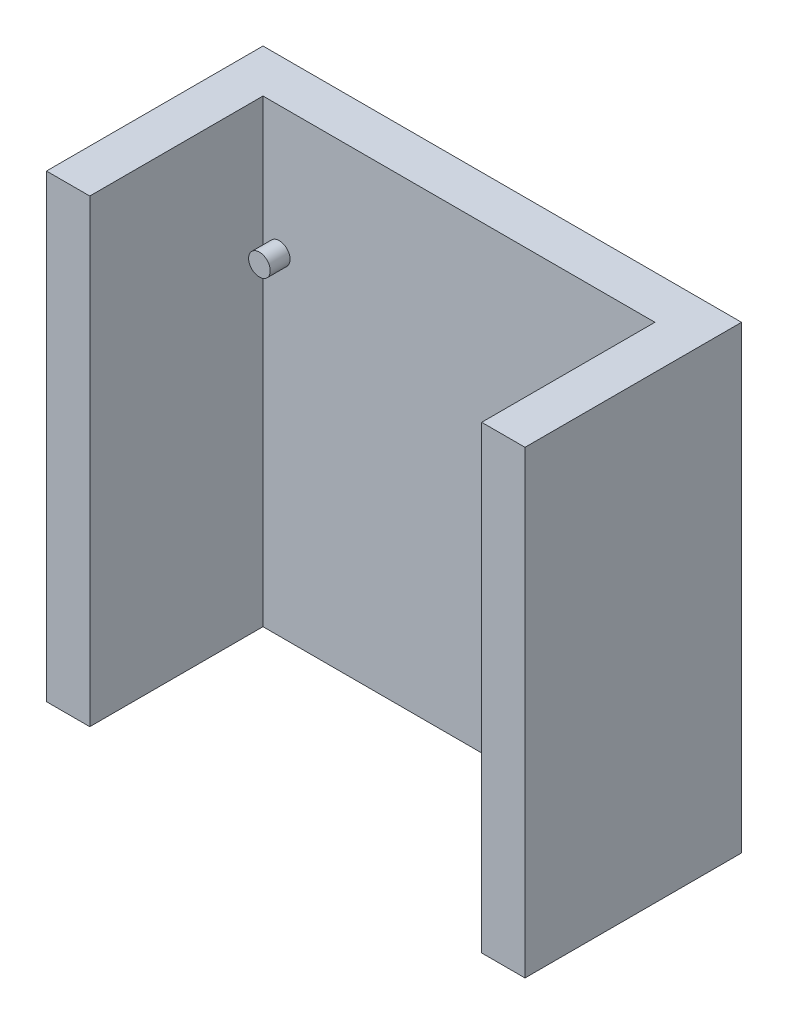
from build123d import *

# Parameters (mm, degrees)
SKETCH3_W             = 145
SKETCH3_H             = 0.3
BOSS_EXTRUDE1_DEPTH   = 1250
BOSS_EXTRUDE2_DEPTH   = 1250
BOSS_EXTRUDE2_2_DEPTH = 1250
BOSS_EXTRUDE2_3_DEPTH = 1250
SKETCH5_W             = 460.32256347
SKETCH5_H             = 1322.59999933
BOSS_EXTRUDE3_DEPTH   = 10
SKETCH6_W             = 460.32256347
SKETCH6_H             = 1322.59999933
BOSS_EXTRUDE5_DEPTH   = 10
SKETCH10_R            = 50
SKETCH12_R            = 50
SKETCH14_R            = 51
SKETCH14_R_2          = 50
SKETCH17_R            = 50
SKETCH13_W            = 1810
SKETCH13_H            = 2122.59999933
SKETCH13_R            = 50
SKETCH13_R_2          = 51
BOSS_EXTRUDE6_DEPTH   = 200
SKETCH20_W            = 200
SKETCH20_H            = 1000
BOSS_EXTRUDE7_DEPTH   = 2122.599999


with BuildPart() as part:
    # Sketch3 → Boss-Extrude1 (new body)
    with BuildSketch(Plane(origin=(0, 0, 0), x_dir=(0, 0, -1), z_dir=(1, 0, 0))):
        with BuildLine():
            add(Edge.make_bspline(
                [(2.48e-07, 3.35e-07), (55.488161595, 74.987946486), (168.36864354, 167.522485923)],
                knots=[0, 0, 0, 0.70182269, 0.70182269, 0.70182269], degree=2))
            add(Edge.make_bspline(
                [(168.36864354, 167.522485923), (216.32719333, 206.836831862), (274.645466506, 249.318463092)],
                knots=[0.70182269, 0.70182269, 0.70182269, 1, 1, 1], degree=2))
            Line((274.645466506, 249.318463092), (274.292192209, 249.803434504))
            add(Edge.make_bspline(
                [(0.6, 1.813912706), (1.431880585, 2.929500885), (3.098081699, 5.144557566), (6.522302801, 9.620243286), (10.936952293, 15.249635367), (16.461379679, 22.076486865), (24.125535977, 31.268787701), (34.266894078, 42.930262812), (47.333785728, 57.197157848), (61.298121724, 71.737552805), (81.11380395, 91.489513551), (108.127067674, 116.863737039), (138.132064611, 143.150935141), (163.931222819, 164.728757618), (184.178180647, 181.186197846), (205.322821331, 197.917810568), (223.69122823, 212.089176502), (238.835170676, 223.563652253), (250.41650891, 232.237308995), (260.257949546, 239.524898736), (268.235899963, 245.38385152), (272.275786984, 248.334595005), (274.292192209, 249.803434504)],
                knots=[0.504877401, 0.504877401, 0.504877401, 0.504877401, 0.504963051, 0.505048701, 0.505220001, 0.505391301, 0.505562601, 0.505905201, 0.506247801, 0.5065904, 0.506933, 0.5076182, 0.508303399, 0.508645999, 0.508988599, 0.509331199, 0.509673799, 0.509845099, 0.510016398, 0.510187698, 0.510273348, 0.510358998, 0.510358998, 0.510358998, 0.510358998], degree=3))
            Line((0.6, 1.813912706), (0.6, 145))
            Line((0.6, 145), (0, 145))
            Line((0, 145), (0, 144.7))
            Line((1e-09, 144.7), (2.48e-07, 3.35e-07))
        make_face()
        Polygon((0, 255), (0, 145), (0.6, 145), (10, 145), (10, 265), (-155, 265), (-155, 145), (-145.6, 145), (-145, 145), (-145, 255), align=None)
        with Locations((-72.5, 144.85)):
            Rectangle(SKETCH3_W, SKETCH3_H)
        with BuildLine():
            add(Edge.make_bspline(
                [(274.864177844, -81.240254391), (273.157555823, -81.908314485), (269.733829537, -83.241505299), (262.941654289, -85.858117417), (254.510317822, -89.053086213), (244.50096298, -92.760277041), (231.294495376, -97.536119599), (215.049955023, -103.191748393), (195.977414467, -109.476093263), (177.325927798, -115.257936974), (153.018554388, -122.297060264), (123.686593004, -129.839640987), (90.171547783, -136.880361962), (63.644156709, -141.071994361), (43.264196312, -143.419639805), (28.397236209, -144.677451966), (16.366230175, -145.306441238), (6.934113164, -145.558059675), (2.319957621, -145.600000001), (-1.73e-07, -145.6)],
                knots=[0.503870094, 0.503870094, 0.503870094, 0.503870094, 0.50394168, 0.504013267, 0.50415644, 0.504299613, 0.504442786, 0.504729131, 0.505015477, 0.505301823, 0.505588169, 0.506160861, 0.506733552, 0.507306244, 0.50759259, 0.507878936, 0.508165281, 0.508308454, 0.508451627, 0.508451627, 0.508451627, 0.508451627], degree=3))
            ThreePointArc((-1.73e-07, -145.6), (-102.954747402, -102.95474728), (-145.6, 0))
            Line((-145.6, 0), (-145.6, 145))
            Line((-145.6, 145), (-145, 145))
            Line((-145, 145), (-145, 0))
            ThreePointArc((-145, 0), (-102.530483394, -102.53048315), (-3.45e-07, -145))
            add(Edge.make_bspline(
                [(-3.45e-07, -145), (110.337933623, -145.000000101), (274.645466839, -80.681536666)],
                knots=[0, 0, 0, 1, 1, 1], degree=2))
            Line((274.645466839, -80.681536666), (274.864177844, -81.240254391))
        make_face()
        Polygon((274.645466839, -80.681536666), (168.36864354, 167.522485923), (172.045740171, 169.09695738), (278.32256347, -79.107065209), align=None)
        with BuildLine():
            Line((-145, 574.999999665), (-145.6, 574.999999665))
            Line((-145.6, 574.999999665), (-145.6, 429.999999665))
            ThreePointArc((-145.6, 429.999999665), (-102.954747402, 327.045252385), (-1.73e-07, 284.399999665))
            add(Edge.make_bspline(
                [(274.864177844, 348.759745274), (273.157555823, 348.09168518), (269.733829537, 346.758494366), (262.941654289, 344.141882248), (254.510317822, 340.946913452), (244.50096298, 337.239722624), (231.294495376, 332.463880066), (215.049955023, 326.808251272), (195.977414467, 320.523906402), (177.325927798, 314.742062691), (153.018554388, 307.702939401), (123.686593004, 300.160358678), (90.171547783, 293.119637703), (63.644156709, 288.928005304), (43.264196312, 286.58035986), (28.397236209, 285.322547699), (16.366230175, 284.693558427), (6.934113164, 284.44193999), (2.319957621, 284.399999664), (-1.73e-07, 284.399999665)],
                knots=[0.503870094, 0.503870094, 0.503870094, 0.503870094, 0.50394168, 0.504013267, 0.50415644, 0.504299613, 0.504442786, 0.504729131, 0.505015477, 0.505301823, 0.505588169, 0.506160861, 0.506733552, 0.507306244, 0.50759259, 0.507878936, 0.508165281, 0.508308454, 0.508451627, 0.508451627, 0.508451627, 0.508451627], degree=3))
            Line((274.864177844, 348.759745274), (274.645466839, 349.318462999))
            add(Edge.make_bspline(
                [(-3.45e-07, 284.999999665), (110.337933732, 284.999999565), (274.645466839, 349.318462999)],
                knots=[0, 0, 0, 1, 1, 1], degree=2))
            ThreePointArc((-3.45e-07, 284.999999665), (-102.530483226, 327.469516682), (-145, 429.999999665))
            Line((-145, 429.999999665), (-145, 574.699999665))
            Line((-145, 574.699999665), (-145, 574.999999665))
        make_face()
        Polygon((168.36864354, 597.522485588), (172.045740171, 599.096957045), (278.32256347, 350.892934456), (274.645466839, 349.318462999), align=None)
        with BuildLine():
            Line((0.6, 574.999999665), (0, 574.999999665))
            Line((0, 574.999999665), (0, 574.699999665))
            Line((0, 574.699999665), (0, 430))
            add(Edge.make_bspline(
                [(0, 430), (55.488161478, 504.987946171), (168.368643516, 597.522485618)],
                knots=[0, 0, 0, 0.70182269, 0.70182269, 0.70182269], degree=2))
            add(Edge.make_bspline(
                [(168.368643516, 597.522485618), (216.327193325, 636.836831544), (274.645466506, 679.318462757)],
                knots=[0.70182269, 0.70182269, 0.70182269, 1, 1, 1], degree=2))
            Line((274.645466506, 679.318462757), (274.292192209, 679.803434169))
            add(Edge.make_bspline(
                [(0.6, 431.813912371), (1.431880585, 432.92950055), (3.098081699, 435.144557231), (6.522302801, 439.620242951), (10.936952293, 445.249635032), (16.461379679, 452.07648653), (24.125535977, 461.268787366), (34.266894078, 472.930262477), (47.333785728, 487.197157513), (61.298121724, 501.73755247), (81.11380395, 521.489513216), (108.127067674, 546.863736704), (138.132064611, 573.150934806), (163.931222819, 594.728757283), (184.178180647, 611.186197511), (205.322821331, 627.917810233), (223.69122823, 642.089176167), (238.835170676, 653.563651918), (250.41650891, 662.23730866), (260.257949546, 669.524898401), (268.235899963, 675.383851185), (272.275786984, 678.33459467), (274.292192209, 679.803434169)],
                knots=[0.504877401, 0.504877401, 0.504877401, 0.504877401, 0.504963051, 0.505048701, 0.505220001, 0.505391301, 0.505562601, 0.505905201, 0.506247801, 0.5065904, 0.506933, 0.5076182, 0.508303399, 0.508645999, 0.508988599, 0.509331199, 0.509673799, 0.509845099, 0.510016398, 0.510187698, 0.510273348, 0.510358998, 0.510358998, 0.510358998, 0.510358998], degree=3))
            Line((0.6, 431.813912371), (0.6, 574.999999665))
        make_face()
        Polygon((-155, 574.999999665), (-155, 694.999999665), (10, 694.999999665), (10, 574.999999665), (0, 574.999999665), (0, 684.999999665), (-145, 684.999999665), (-145, 574.999999665), align=None)
        with Locations((-72.5, 574.849999665)):
            Rectangle(SKETCH3_W, SKETCH3_H)
        Polygon((168.36864354, 1027.522485253), (172.045740171, 1029.09695671), (278.32256347, 780.892934121), (274.645466839, 779.318462664), align=None)
        with BuildLine():
            Line((-145, 1004.99999933), (-145.6, 1004.99999933))
            Line((-145.6, 1004.99999933), (-145.6, 859.99999933))
            ThreePointArc((-145.6, 859.99999933), (-102.954747402, 757.04525205), (-1.73e-07, 714.39999933))
            add(Edge.make_bspline(
                [(274.864177844, 778.759744939), (273.157555823, 778.091684845), (269.733829537, 776.758494031), (262.941654289, 774.141881913), (254.510317822, 770.946913117), (244.50096298, 767.239722289), (231.294495376, 762.463879731), (215.049955023, 756.808250937), (195.977414467, 750.523906067), (177.325927798, 744.742062356), (153.018554388, 737.702939066), (123.686593004, 730.160358343), (90.171547783, 723.119637368), (63.644156709, 718.928004969), (43.264196312, 716.580359525), (28.397236209, 715.322547364), (16.366230175, 714.693558092), (6.934113164, 714.441939655), (2.319957621, 714.399999329), (-1.73e-07, 714.39999933)],
                knots=[0.503870094, 0.503870094, 0.503870094, 0.503870094, 0.50394168, 0.504013267, 0.50415644, 0.504299613, 0.504442786, 0.504729131, 0.505015477, 0.505301823, 0.505588169, 0.506160861, 0.506733552, 0.507306244, 0.50759259, 0.507878936, 0.508165281, 0.508308454, 0.508451627, 0.508451627, 0.508451627, 0.508451627], degree=3))
            Line((274.864177844, 778.759744939), (274.645466839, 779.318462664))
            add(Edge.make_bspline(
                [(-3.45e-07, 714.99999933), (110.337933732, 714.999999229), (274.645466839, 779.318462664)],
                knots=[0, 0, 0, 1, 1, 1], degree=2))
            ThreePointArc((-3.45e-07, 714.99999933), (-102.530483226, 757.469516348), (-145, 859.99999933))
            Line((-145, 859.99999933), (-145, 1004.69999933))
            Line((-145, 1004.69999933), (-145, 1004.99999933))
        make_face()
        with BuildLine():
            Line((0.6, 1004.99999933), (0, 1004.99999933))
            Line((0, 1004.99999933), (0, 1004.69999933))
            Line((0, 1004.69999933), (0, 859.999999665))
            add(Edge.make_bspline(
                [(0, 859.999999665), (55.488161478, 934.987945836), (168.368643516, 1027.522485283)],
                knots=[0, 0, 0, 0.70182269, 0.70182269, 0.70182269], degree=2))
            add(Edge.make_bspline(
                [(168.368643516, 1027.522485283), (216.327193325, 1066.836831209), (274.645466506, 1109.318462422)],
                knots=[0.70182269, 0.70182269, 0.70182269, 1, 1, 1], degree=2))
            Line((274.645466506, 1109.318462422), (274.292192209, 1109.803433834))
            add(Edge.make_bspline(
                [(0.6, 861.813912036), (1.431880585, 862.929500215), (3.098081699, 865.144556896), (6.522302801, 869.620242616), (10.936952293, 875.249634697), (16.461379679, 882.076486195), (24.125535977, 891.268787031), (34.266894078, 902.930262142), (47.333785728, 917.197157178), (61.298121724, 931.737552135), (81.11380395, 951.489512881), (108.127067674, 976.863736369), (138.132064611, 1003.150934471), (163.931222819, 1024.728756948), (184.178180647, 1041.186197176), (205.322821331, 1057.917809898), (223.69122823, 1072.089175832), (238.835170676, 1083.563651583), (250.41650891, 1092.237308325), (260.257949546, 1099.524898066), (268.235899963, 1105.38385085), (272.275786984, 1108.334594335), (274.292192209, 1109.803433834)],
                knots=[0.504877401, 0.504877401, 0.504877401, 0.504877401, 0.504963051, 0.505048701, 0.505220001, 0.505391301, 0.505562601, 0.505905201, 0.506247801, 0.5065904, 0.506933, 0.5076182, 0.508303399, 0.508645999, 0.508988599, 0.509331199, 0.509673799, 0.509845099, 0.510016398, 0.510187698, 0.510273348, 0.510358998, 0.510358998, 0.510358998, 0.510358998], degree=3))
            Line((0.6, 861.813912036), (0.6, 1004.99999933))
        make_face()
        with Locations((-72.5, 1004.84999933)):
            Rectangle(SKETCH3_W, SKETCH3_H)
        Polygon((-155, 1004.99999933), (-155, 1124.99999933), (10, 1124.99999933), (10, 1004.99999933), (0, 1004.99999933), (0, 1114.99999933), (-145, 1114.99999933), (-145, 1004.99999933), align=None)
    extrude(amount=-BOSS_EXTRUDE1_DEPTH)


with BuildPart() as body_2:
    # Sketch4 → Boss-Extrude2 (new body)
    with BuildSketch(Plane(origin=(0, 0, 0), x_dir=(0, 0, -1), z_dir=(1, 0, 0))):
        Polygon((-180, 1149.99999933), (278.32256347, 1149.99999933), (278.32256347, 1109.318462422), (274.645466506, 1109.318462422), (274.645466506, 1108.318462422), (279.32256347, 1108.318462422), (279.32256347, 1150.99999933), (-181, 1150.99999933), (-181, -171.6), (279.32256347, -171.6), (279.32256347, -79.107065209), (278.32256347, -79.107065209), (278.32256347, -170.6), (-180, -170.6), align=None)
    extrude(amount=-BOSS_EXTRUDE2_DEPTH)



with BuildPart() as body_3:
    # Sketch4 → Boss-Extrude2 2 (new body)
    with BuildSketch(Plane(origin=(0, 0, 0), x_dir=(0, 0, -1), z_dir=(1, 0, 0))):
        Polygon((274.645466506, 679.318462757), (278.32256347, 679.318462757), (278.32256347, 780.892934121), (279.32256347, 780.892934121), (279.32256347, 678.318462757), (274.645466506, 678.318462757), align=None)
    extrude(amount=-BOSS_EXTRUDE2_2_DEPTH)


with BuildPart() as body_4:
    # Sketch4 → Boss-Extrude2 3 (new body)
    with BuildSketch(Plane(origin=(0, 0, 0), x_dir=(0, 0, -1), z_dir=(1, 0, 0))):
        Polygon((274.645466506, 249.318463092), (278.32256347, 249.318463092), (278.32256347, 350.892934456), (279.32256347, 350.892934456), (279.32256347, 248.318463092), (274.645466506, 248.318463092), align=None)
    extrude(amount=-BOSS_EXTRUDE2_3_DEPTH)


with BuildPart() as body_5:
    # Sketch5 → Boss-Extrude3 (new body)
    with BuildSketch(Plane(origin=(0, 0, 0), x_dir=(0, 0, -1), z_dir=(1, 0, 0))):
        with Locations((49.161281735, 489.699999665)):
            Rectangle(SKETCH5_W, SKETCH5_H)
    extrude(amount=BOSS_EXTRUDE3_DEPTH)

    # Sweep4: sweep along a path in Sketch11
    with BuildLine(Plane.XY.offset(72.5)) as sweep4_path:
        Line((10, 630), (160, 630))
        Line((160, 630), (160, 806.299137657))
        Line((160, 806.299137657), (10, 806.299137657))
    # Sketch12 → Sweep4 (sweep)
    with BuildSketch(Plane(origin=(10, 0, 0), x_dir=(0, 0, -1), z_dir=(1, 0, 0))):
        with Locations((-72.5, 630)):
            Circle(SKETCH12_R)
    sweep(path=sweep4_path.line, transition=Transition.RIGHT)

    # Sweep5: sweep along a path in Sketch15
    with BuildLine(Plane(origin=(0, -53.700862343, 0), x_dir=(1, 0, 0), z_dir=(0, 1, 0))) as sweep5_path:
        Line((10, -72.5), (210, -72.5))
        Line((210, -72.5), (210, -472.5))
    # Sketch14 → Sweep5 (sweep)
    with BuildSketch(Plane(origin=(10, 0, 0), x_dir=(0, 0, -1), z_dir=(1, 0, 0))):
        with Locations((-72.5, -53.700862343)):
            Circle(SKETCH14_R)
        with Locations((-72.5, -53.700862343)):
            Circle(SKETCH14_R_2, mode=Mode.SUBTRACT)
    sweep(path=sweep5_path.line, transition=Transition.RIGHT)


with BuildPart() as body_6:
    # Sketch6 → Boss-Extrude5 (new body)
    with BuildSketch(Plane.ZY.offset(1250)):
        with Locations((-49.161281735, 489.699999665)):
            Rectangle(SKETCH6_W, SKETCH6_H)
    extrude(amount=BOSS_EXTRUDE5_DEPTH)

    # Sweep3: sweep along a path in Sketch9
    with BuildLine(Plane.XY.offset(72.5)) as sweep3_path:
        Line((-1260, 200), (-1410, 200))
        Line((-1410, 200), (-1410, 376.299137657))
        Line((-1410, 376.299137657), (-1260, 376.299137657))
    # Sketch10 → Sweep3 (sweep)
    with BuildSketch(Plane.ZY.offset(1260)):
        with Locations((72.5, 200)):
            Circle(SKETCH10_R)
    sweep(path=sweep3_path.line, transition=Transition.RIGHT)

    # Sweep6: sweep along a path in Sketch18
    with BuildLine(Plane(origin=(0, 1060, 0), x_dir=(1, 0, 0), z_dir=(0, 1, 0))) as sweep6_path:
        Line((-1260, -72.5), (-1460, -72.5))
        Line((-1460, -72.5), (-1460, -472.5))
    # Sketch17 → Sweep6 (sweep)
    with BuildSketch(Plane.ZY.offset(1260)):
        with Locations((72.5, 1060)):
            Circle(SKETCH17_R)
    sweep(path=sweep6_path.line, transition=Transition.RIGHT)


with BuildPart() as body_2_1:
    add(body_2.part)

    add(body_5.part)  # Boss-Extrude6 merges body 5

    add(body_6.part)  # Boss-Extrude6 merges body 6
    # Sketch13 → Boss-Extrude6 (add)
    with BuildSketch(Plane.XY.offset(181)):
        with Locations((-630, 589.699999665)):
            Rectangle(SKETCH13_W, SKETCH13_H)
        with Locations((-1460, 1060)):
            Circle(SKETCH13_R, mode=Mode.SUBTRACT)
        with Locations((210, -53.700862343)):
            Circle(SKETCH13_R_2, mode=Mode.SUBTRACT)
    extrude(amount=BOSS_EXTRUDE6_DEPTH)

    # Sketch20 → Boss-Extrude7 (add, through all)
    with BuildSketch(Plane(origin=(0, 1650.99999933, 0), x_dir=(1, 0, 0), z_dir=(0, 1, 0))):
        with Locations((-1635, -681)):
            Rectangle(SKETCH20_W, SKETCH20_H)
        with Locations((375, -681)):
            Rectangle(SKETCH20_W, SKETCH20_H)
    extrude(amount=-BOSS_EXTRUDE7_DEPTH)


solid = Compound([part.part, body_3.part, body_4.part, body_2_1.part])
